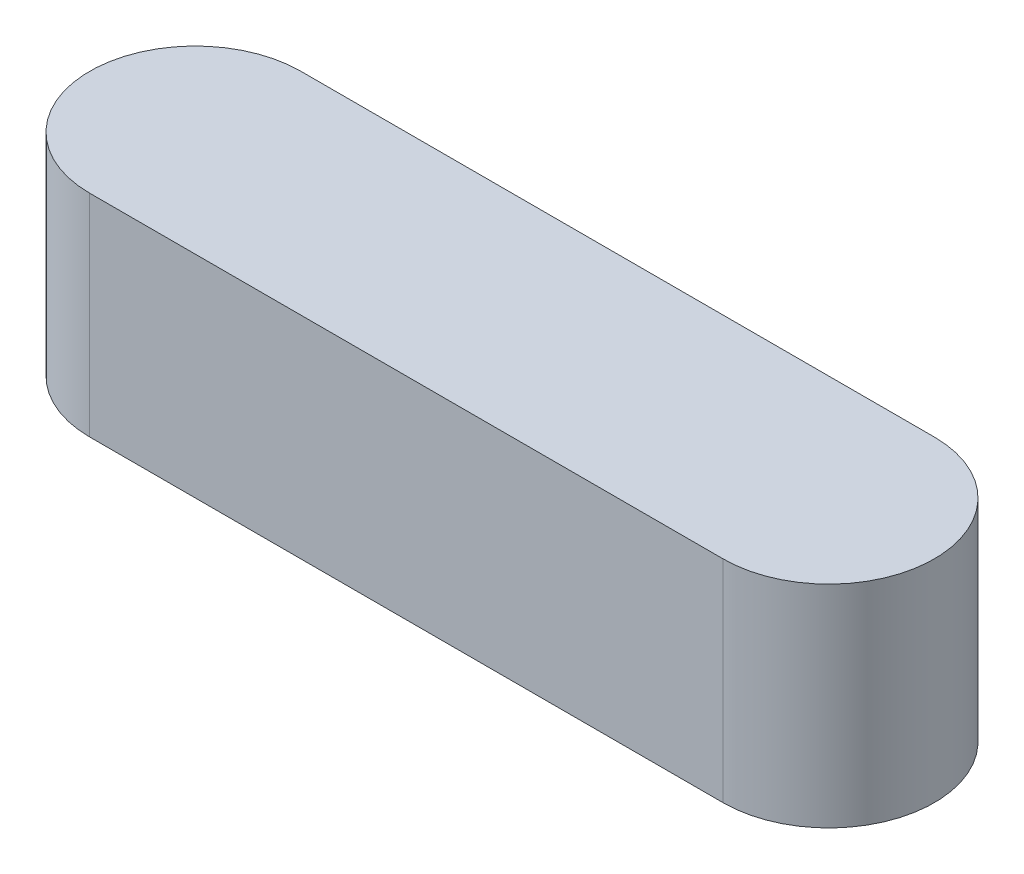
from build123d import *

# Parameters (mm, degrees)
SKETCH1_W           = 12.7
SKETCH1_H           = 3.175
BOSS_EXTRUDE1_DEPTH = 3.175
FILLET1_RADIUS      = 1.5875
FILLET1_LENGTH      = 3.175
FILLET2_RADIUS      = 1.5875
FILLET2_LENGTH      = 3.175


with BuildPart() as part:
    # Sketch1 → Boss-Extrude1 (new body)
    with BuildSketch(Plane.XY):
        with Locations((6.35, 1.5875)):
            Rectangle(SKETCH1_W, SKETCH1_H)
    extrude(amount=BOSS_EXTRUDE1_DEPTH)

    # Fillet1: full round fillet: the end face becomes a half cylinder, R = half its width
    fillet1_face = Plane((12.7, 1.5875, 1.5875), x_dir=(0, -1, 0), z_dir=(1, 0, 0))  # on the end face: x along it, z out of the body
    fillet1_slab = fillet1_face.offset(-FILLET1_RADIUS / 2) * Box(FILLET1_LENGTH, 2 * FILLET1_RADIUS, FILLET1_RADIUS, mode=Mode.PRIVATE)  # the body's end, R deep
    fillet1_round = Plane((11.1125, 1.5875, 1.5875), x_dir=(1, 0, 0), z_dir=(0, -1, 0)) * Cylinder(FILLET1_RADIUS, FILLET1_LENGTH, mode=Mode.PRIVATE)  # its axis R under the face
    add(fillet1_slab - fillet1_round, mode=Mode.SUBTRACT)

    # Fillet2: full round fillet: the end face becomes a half cylinder, R = half its width
    fillet2_face = Plane((0, 1.5875, 1.5875), x_dir=(0, 1, 0), z_dir=(-1, 0, 0))  # on the end face: x along it, z out of the body
    fillet2_slab = fillet2_face.offset(-FILLET2_RADIUS / 2) * Box(FILLET2_LENGTH, 2 * FILLET2_RADIUS, FILLET2_RADIUS, mode=Mode.PRIVATE)  # the body's end, R deep
    fillet2_round = Plane((1.5875, 1.5875, 1.5875), x_dir=(-1, 0, 0), z_dir=(0, 1, 0)) * Cylinder(FILLET2_RADIUS, FILLET2_LENGTH, mode=Mode.PRIVATE)  # its axis R under the face
    add(fillet2_slab - fillet2_round, mode=Mode.SUBTRACT)


solid = part.part
